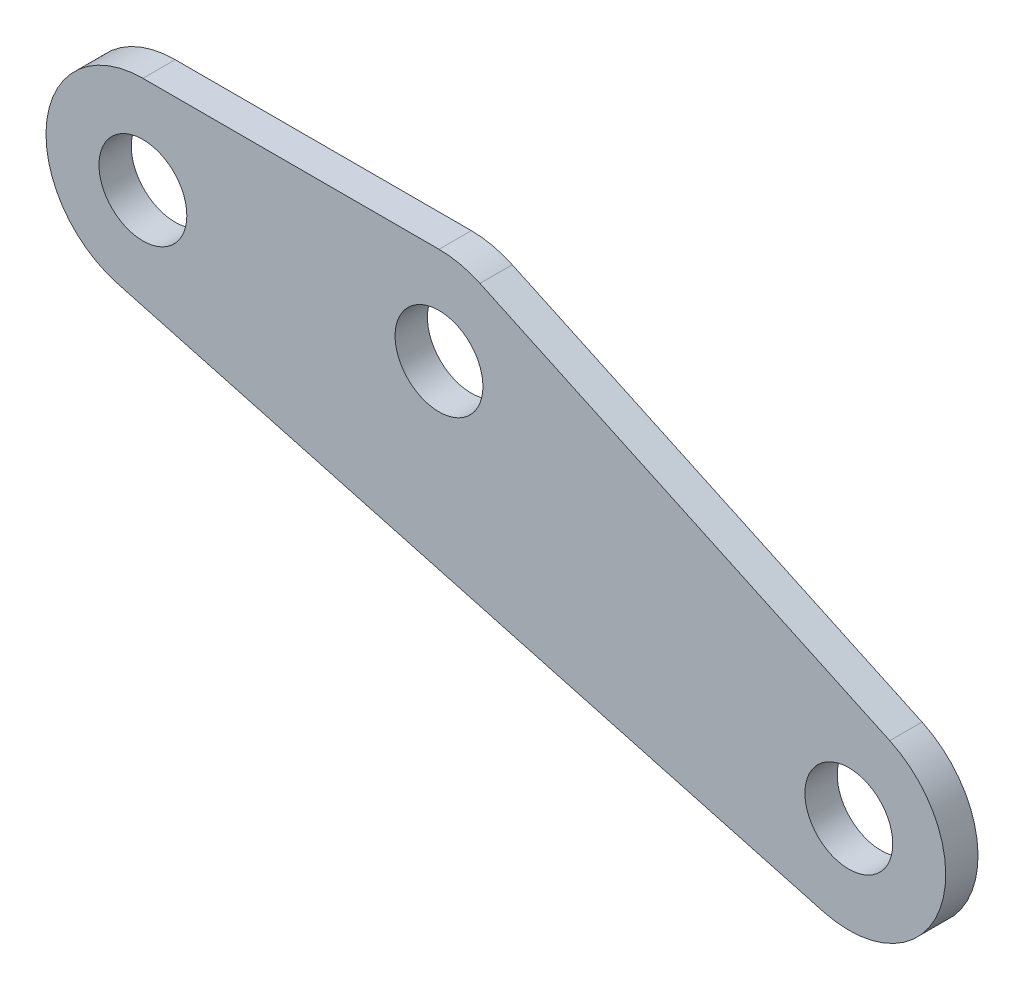
from build123d import *

# Parameters (mm, degrees)
SKETCH1_R           = 2.159
BOSS_EXTRUDE1_DEPTH = 1.5875


with BuildPart() as part:
    # Sketch1 → Boss-Extrude1 (new body)
    with BuildSketch(Plane.XY):
        with BuildLine():
            Line((16.566919472, 4.316290836), (36.709610038, -5.076400031))
            ThreePointArc((36.709610038, -5.076400031), (39.170078831, -11.027314066), (33.452440479, -13.989727981))
            Line((33.452440479, -13.989727981), (-1.244450088, -4.597037114))
            ThreePointArc((-1.244450088, -4.597037114), (-4.720953056, 0.627700961), (0, 4.7625))
            Line((0, 4.7625), (14.5542, 4.7625))
            ThreePointArc((14.5542, 4.7625), (15.584993661, 4.649609734), (16.566919472, 4.316290836))
        make_face()
        Circle(SKETCH1_R, mode=Mode.SUBTRACT)
        with Locations((14.5542, 0)):
            Circle(SKETCH1_R, mode=Mode.SUBTRACT)
        with Locations((34.696890567, -9.392690867)):
            Circle(SKETCH1_R, mode=Mode.SUBTRACT)
    extrude(amount=BOSS_EXTRUDE1_DEPTH)


solid = part.part
